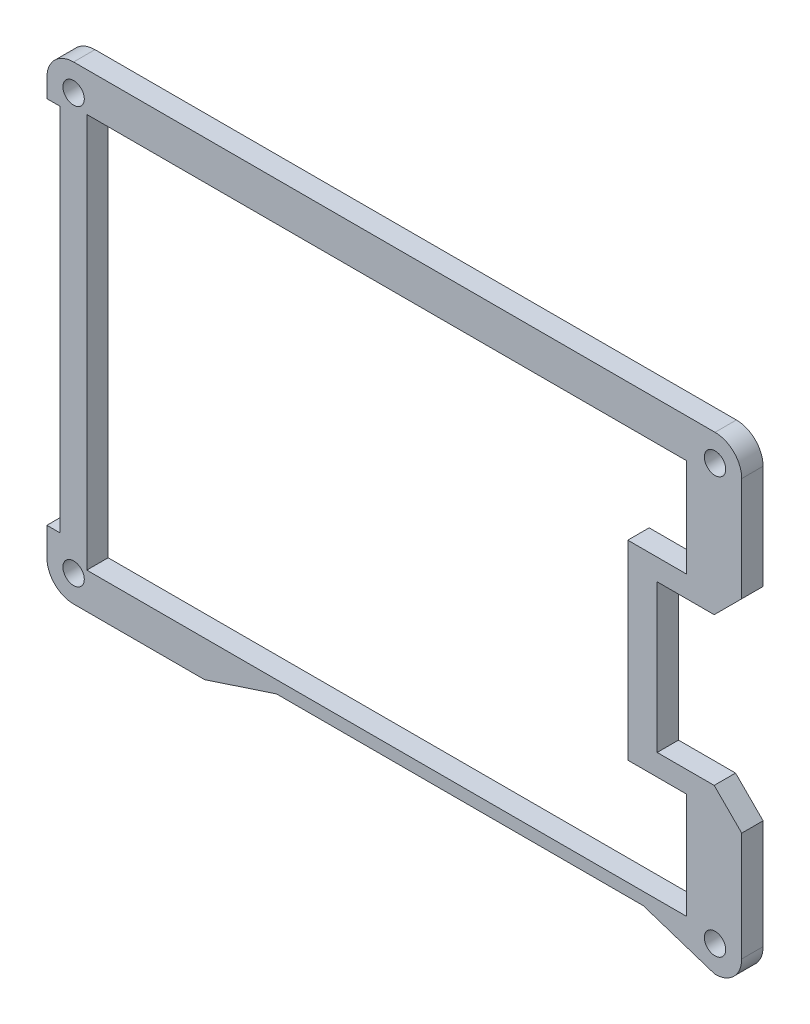
from build123d import *

# Parameters (mm, degrees)
BOSS_EXTRUDE1_DEPTH = 3.048
SKETCH2_R           = 1.355900406
CUT_EXTRUDE1_DEPTH  = 430.898988368
SKETCH3_R           = 1.524
CUT_EXTRUDE2_DEPTH  = 430.898988368
CUT_EXTRUDE3_DEPTH  = 430.898988368
SKETCH4_4_W         = 8.3947
SKETCH4_4_H         = 2.41935
BOSS_EXTRUDE2_DEPTH = 3.048


with BuildPart() as part:
    # Sketch1 → Boss-Extrude1 (new body)
    with BuildSketch(Plane.XY):
        with BuildLine():
            Line((-309.8086, 128.8851), (-305.87795, 128.8851))
            Line((-305.87795, 128.8851), (-301.9473, 132.81575))
            Line((-301.9473, 132.81575), (-301.9473, 150.9704))
            ThreePointArc((-301.9473, 150.9704), (-303.063223164, 153.664476836), (-305.7573, 154.7804))
            Line((-305.7573, 154.7804), (-397.247125, 154.7804))
            ThreePointArc((-397.247125, 154.7804), (-399.946077222, 153.659592612), (-401.0571, 150.956597849))
            Line((-401.0571, 150.956597849), (-401.0571, 148.341))
            Line((-401.0571, 148.341), (-399.1521, 148.341))
            Line((-399.1521, 148.341), (-399.1521, 95.6449))
            Line((-399.1521, 95.6449), (-401.0571, 95.6449))
            Line((-401.0571, 95.6449), (-401.0571, 91.659304166))
            ThreePointArc((-401.0571, 91.659304166), (-399.951018769, 88.947400452), (-397.2472, 87.8217))
            Line((-397.2472, 87.8217), (-378.5565, 87.8217))
            Line((-378.5565, 87.8217), (-368.3165, 91.1883))
            Line((-368.3165, 91.1883), (-315.9973, 91.1883))
            Line((-315.9973, 91.1883), (-305.7573, 87.8217))
            ThreePointArc((-305.7573, 87.8217), (-303.063223164, 88.937623164), (-301.9473, 91.6317))
            Line((-301.9473, 91.6317), (-301.9473, 111.74645))
            Line((-301.9473, 111.74645), (-305.87795, 115.6771))
            Line((-305.87795, 115.6771), (-309.8086, 115.6771))
            Line((-309.8086, 115.6771), (-314.0123, 115.6771))
            Line((-314.0123, 115.6771), (-314.0123, 128.8851))
            Line((-314.0123, 128.8851), (-309.8086, 128.8851))
        make_face()
        Polygon((-395.3675, 92.9525), (-395.3675, 149.2432), (-309.8086, 149.2432), (-309.8086, 132.81575), (-318.2033, 132.81575), (-318.2033, 111.74645), (-309.8086, 111.74645), (-309.8086, 92.9525), align=None, mode=Mode.SUBTRACT)
    extrude(amount=BOSS_EXTRUDE1_DEPTH)

    # Sketch2 → Cut-Extrude1 (cut, through all)
    with BuildSketch(Plane(origin=(0, 0, 0), x_dir=(-1, 0, 0), z_dir=(0, 0, -1))):
        with Locations((305.7573, 150.9704)):
            Circle(SKETCH2_R)
        with Locations((397.247125, 150.9704)):
            Circle(SKETCH2_R)
        with Locations((397.2472, 91.6317)):
            Circle(SKETCH2_R)
        with Locations((305.7573, 91.6317)):
            Circle(SKETCH2_R)
    extrude(amount=-CUT_EXTRUDE1_DEPTH, mode=Mode.SUBTRACT)

    # Sketch3 → Cut-Extrude2 (cut, through all)
    with BuildSketch(Plane(origin=(0, 0, 0), x_dir=(-1, 0, 0), z_dir=(0, 0, -1))):
        with Locations((305.7573, 150.9704)):
            Circle(SKETCH3_R)
        with Locations((397.247125, 150.9704)):
            Circle(SKETCH3_R)
        with Locations((397.2472, 91.6317)):
            Circle(SKETCH3_R)
        with Locations((305.7573, 91.6317)):
            Circle(SKETCH3_R)
    extrude(amount=-CUT_EXTRUDE2_DEPTH, mode=Mode.SUBTRACT)

    # Sketch4 → Cut-Extrude3 (cut, through all)
    with BuildSketch(Plane.XY.offset(3.048)):
        Polygon((-301.9473, 111.74645), (-301.9473, 132.81575), (-305.87795, 128.8851), (-314.0123, 128.8851), (-314.0123, 115.6771), (-305.87795, 115.6771), align=None)
        Polygon((-301.9473, 132.81575), (-301.9473, 136.11775), (-305.87795, 132.1871), (-314.0123, 132.1871), (-314.0123, 128.8851), (-305.87795, 128.8851), align=None)
        Polygon((-301.9473, 107.17445), (-301.9473, 111.74645), (-305.87795, 115.6771), (-314.0123, 115.6771), (-314.0123, 111.74645), (-309.8086, 111.74645), (-309.8086, 111.1051), (-305.87795, 111.1051), align=None)
    extrude(amount=-CUT_EXTRUDE3_DEPTH, mode=Mode.SUBTRACT)

    # Sketch4<4> → Boss-Extrude2 (add)
    with BuildSketch(Plane.XY.offset(3.048)):
        Polygon((-301.9473, 104.12645), (-301.9473, 107.17445), (-305.87795, 111.1051), (-309.8086, 111.1051), (-309.8086, 108.0571), (-305.87795, 108.0571), align=None)
        Polygon((-314.0123, 111.1051), (-314.0123, 111.74645), (-318.2033, 111.74645), (-318.2033, 108.0571), (-309.8086, 108.0571), (-309.8086, 111.1051), align=None)
        with Locations((-314.00595, 134.025425)):
            Rectangle(SKETCH4_4_W, SKETCH4_4_H)
    extrude(amount=-BOSS_EXTRUDE2_DEPTH)


solid = part.part
